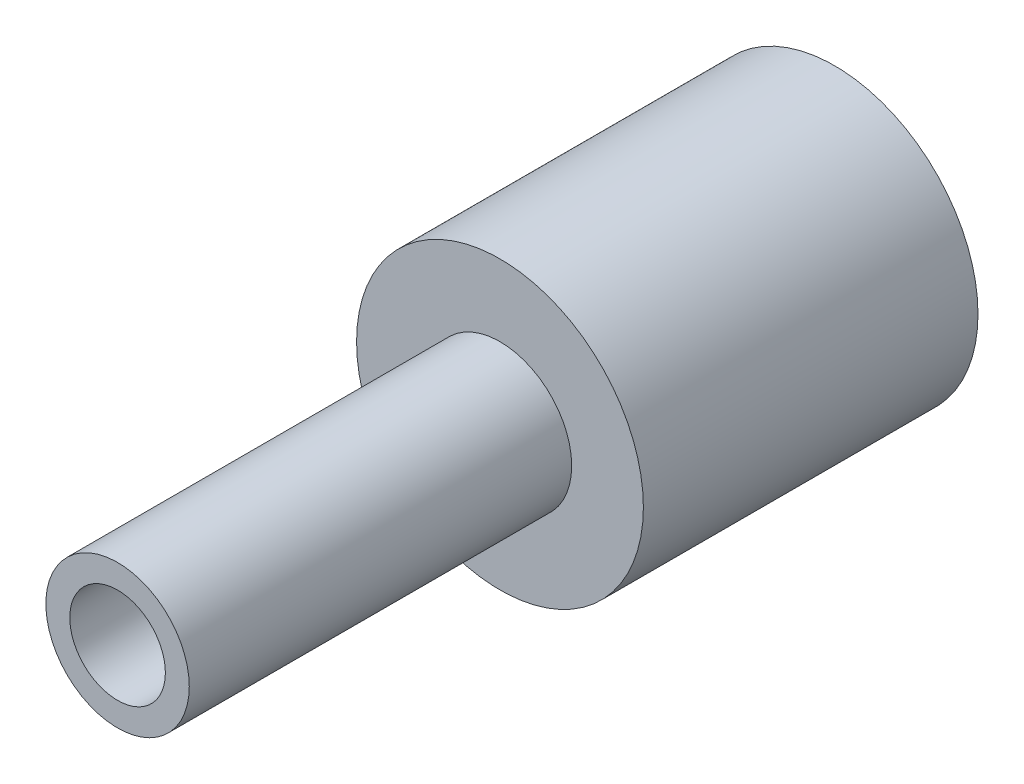
from build123d import *

# Parameters (mm, degrees)
SKETCH1_R           = 38.1
BOSS_EXTRUDE1_DEPTH = 88.9
SKETCH2_R           = 19.05
BOSS_EXTRUDE2_DEPTH = 101.6
SKETCH3_R           = 12.7
CUT_EXTRUDE1_DEPTH  = 202.692


with BuildPart() as part:
    # Sketch1 → Boss-Extrude1 (new body)
    with BuildSketch(Plane.XY):
        Circle(SKETCH1_R)
    extrude(amount=BOSS_EXTRUDE1_DEPTH)

    # Sketch2 → Boss-Extrude2 (add)
    with BuildSketch(Plane.XY.offset(88.9)):
        Circle(SKETCH2_R)
    extrude(amount=BOSS_EXTRUDE2_DEPTH)

    # Sketch3 → Cut-Extrude1 (cut)
    with BuildSketch(Plane.XY.offset(190.5)):
        Circle(SKETCH3_R)
    extrude(amount=-CUT_EXTRUDE1_DEPTH, mode=Mode.SUBTRACT)


solid = part.part
